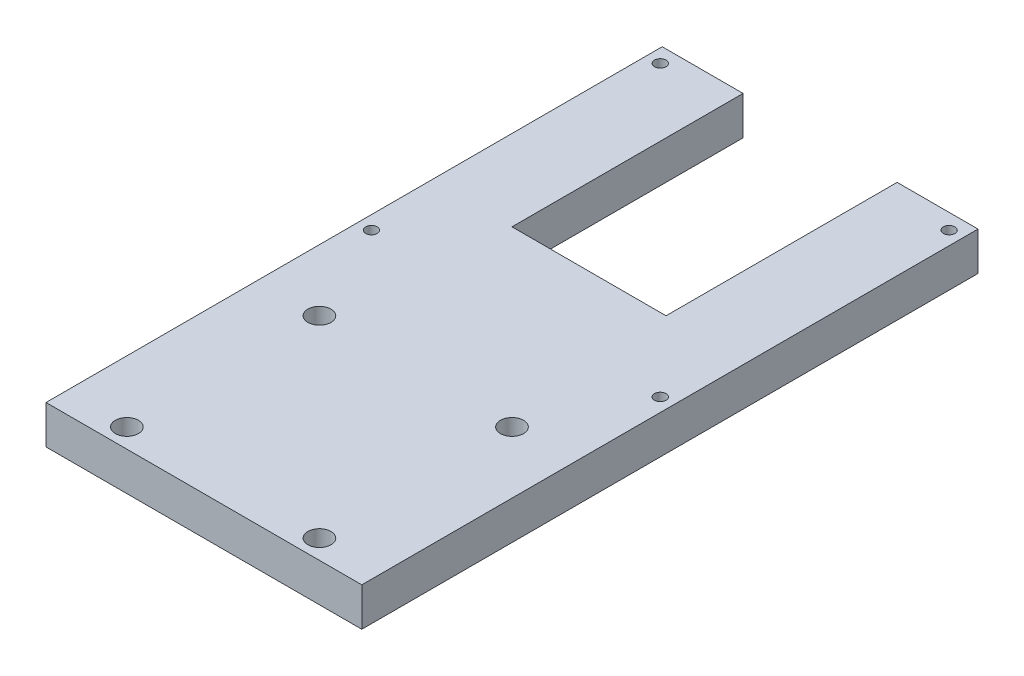
from build123d import *

# Parameters (mm, degrees)
SKETCH1_R           = 3
SKETCH1_R_2         = 1.5
BOSS_EXTRUDE1_DEPTH = 10


with BuildPart() as part:
    # Sketch1 → Boss-Extrude1 (new body)
    with BuildSketch(Plane(origin=(0, 0, 0), x_dir=(1, 0, 0), z_dir=(0, 1, 0))):
        Polygon((32.969203123, -64.744115369), (-49.030796877, -64.744115369), (-49.030796877, 95.255884631), (-28.030796877, 95.255884631), (-28.030796877, 35.255884631), (11.969203123, 35.255884631), (11.969203123, 95.255884631), (32.969203123, 95.255884631), align=None)
        with Locations(Location((-33.030796877, -59.744115369, 0), (0, 0, 270))):
            Circle(SKETCH1_R, mode=Mode.SUBTRACT)
        with Locations(Location((16.969203123, -59.744115369, 0), (0, 0, 270))):
            Circle(SKETCH1_R, mode=Mode.SUBTRACT)
        with Locations(Location((16.969203123, -9.744115369, 0), (0, 0, 270))):
            Circle(SKETCH1_R, mode=Mode.SUBTRACT)
        with Locations(Location((-33.030796877, -9.744115369, 0), (0, 0, 270))):
            Circle(SKETCH1_R, mode=Mode.SUBTRACT)
        with Locations(Location((-45.530796877, 91.255884631, 0), (0, 0, 270))):
            Circle(SKETCH1_R_2, mode=Mode.SUBTRACT)
        with Locations(Location((29.469203123, 91.255884631, 0), (0, 0, 270))):
            Circle(SKETCH1_R_2, mode=Mode.SUBTRACT)
        with Locations(Location((29.469203123, 16.255884631, 0), (0, 0, 270))):
            Circle(SKETCH1_R_2, mode=Mode.SUBTRACT)
        with Locations(Location((-45.530796877, 16.255884631, 0), (0, 0, 270))):
            Circle(SKETCH1_R_2, mode=Mode.SUBTRACT)
    extrude(amount=BOSS_EXTRUDE1_DEPTH)


solid = part.part
